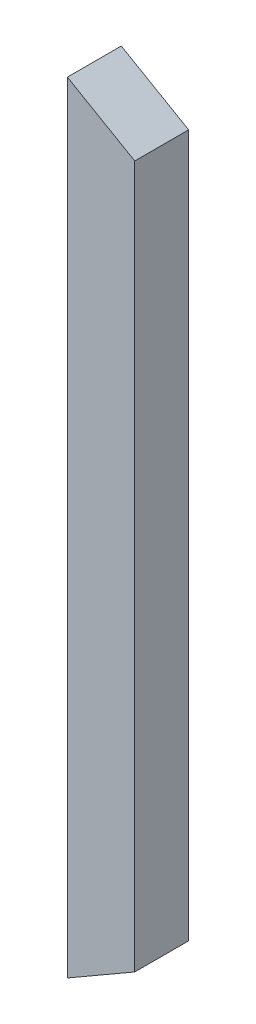
from build123d import *

# Parameters (mm, degrees)
ESQUISSE1_W                  = 50
ESQUISSE1_H                  = 550
BOSS_EXTRU_1_DEPTH           = 40
BOSS_EXTRU_2_DEPTH           = 40
ENL_V_MAT_EXTRU_1_DEPTH      = 554.714727996
ENL_V_MAT_EXTRU_1_DEPTH_BACK = 554.714727996


with BuildPart() as part:
    # Esquisse1 → Boss.-Extru.1 (new body)
    with BuildSketch(Plane.XY):
        with Locations((25, 275)):
            Rectangle(ESQUISSE1_W, ESQUISSE1_H)
    extrude(amount=BOSS_EXTRU_1_DEPTH)

    # Esquisse2 → Boss.-Extru.2 (add)
    with BuildSketch(Plane.XY.offset(40)):
        Polygon((50, 0), (0, 0), (0, -28.867513459), align=None)
    extrude(amount=-BOSS_EXTRU_2_DEPTH)

    # Esquisse3 → Enlèv. mat.-Extru.1 (cut, two sides: drawn at the far end of the back side and taken through both)
    with BuildSketch(Plane.XY.offset(40).offset(-ENL_V_MAT_EXTRU_1_DEPTH_BACK)):
        Polygon((50, 521.132486541), (0, 550), (50, 550), align=None)
    extrude(amount=ENL_V_MAT_EXTRU_1_DEPTH + ENL_V_MAT_EXTRU_1_DEPTH_BACK, mode=Mode.SUBTRACT)


solid = part.part
